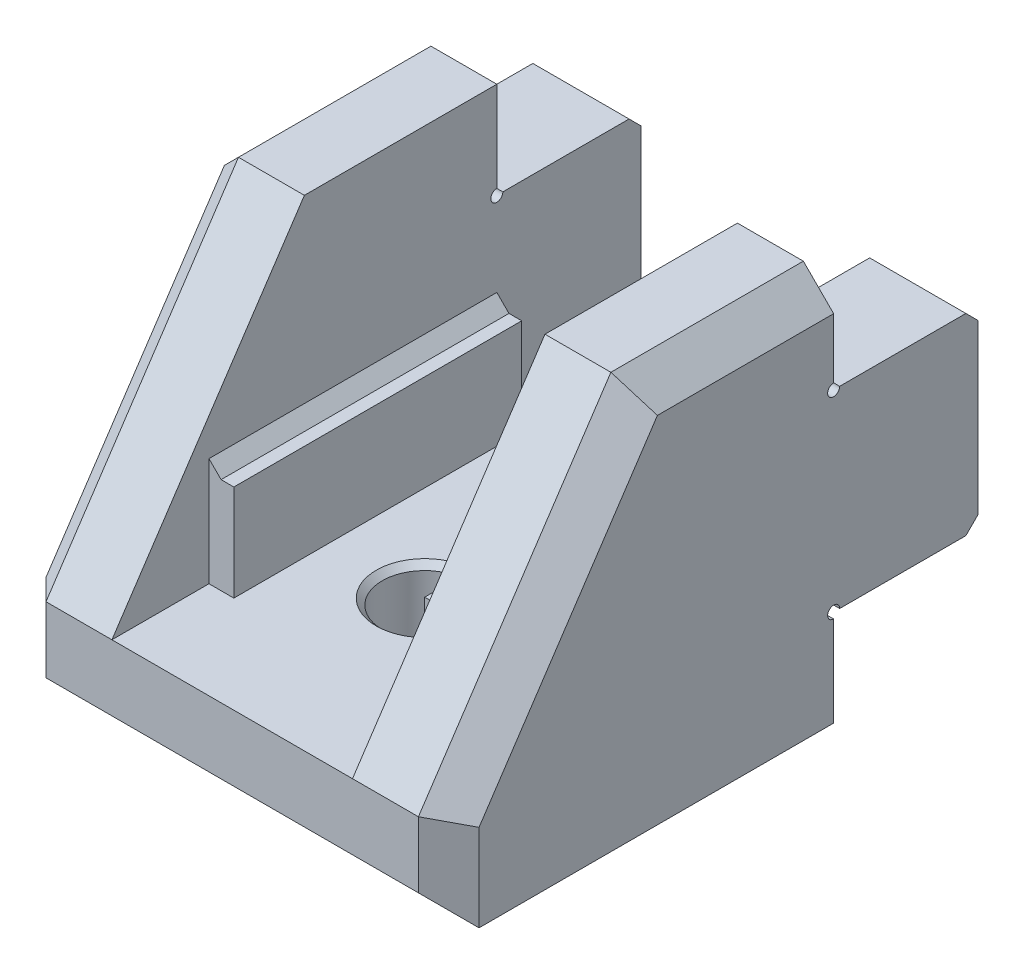
from build123d import *

# Parameters (mm, degrees)
SKETCH1_W                  = 7.9375
SKETCH1_H                  = 12.7
BOSS_EXTRUDE1_DEPTH        = 3.175
SKETCH1_3_W                = 3.175
SKETCH1_3_H                = 12.7
BOSS_EXTRUDE2_DEPTH        = 12.7
CUT_EXTRUDE2_DEPTH         = 21.143116845
BOSS_EXTRUDE3_DEPTH        = 3.175
SKETCH4_W                  = 3.175
SKETCH4_H                  = 6.35
BOSS_EXTRUDE4_DEPTH        = 4.7625
SKETCH5_R                  = 0.1984375
CUT_EXTRUDE3_DEPTH         = 23.11131639
CHAMFER1_SIZE              = 0.4
CHAMFER2_SIZE              = 1
F_35_0_11_DIAMETER_HOLE1_D = 2.794
CHAMFER3_SIZE              = 0.2


with BuildPart() as part:
    # Sketch1 → Boss-Extrude1 (new body)
    with BuildSketch(Plane(origin=(0, 0, 0), x_dir=(1, 0, 0), z_dir=(0, 1, 0))):
        Rectangle(SKETCH1_W, SKETCH1_H)
    extrude(amount=BOSS_EXTRUDE1_DEPTH)

    # Sketch1<3> → Boss-Extrude2 (add)
    with BuildSketch(Plane(origin=(0, 0, 0), x_dir=(1, 0, 0), z_dir=(0, 1, 0))):
        with Locations((5.55625, 0)):
            Rectangle(SKETCH1_3_W, SKETCH1_3_H)
        with Locations((-5.55625, 0)):
            Rectangle(SKETCH1_3_W, SKETCH1_3_H)
    extrude(amount=BOSS_EXTRUDE2_DEPTH)

    # Sketch2 → Cut-Extrude2 (cut, through all)
    with BuildSketch(Plane(origin=(7.14375, 0, 0), x_dir=(0, 0, -1), z_dir=(1, 0, 0))):
        Polygon((-6.35, 3.175), (0, 12.7), (-6.35, 12.7), align=None)
    extrude(amount=-CUT_EXTRUDE2_DEPTH, mode=Mode.SUBTRACT)

    # Sketch3 → Boss-Extrude3 (add)
    with BuildSketch(Plane(origin=(0, 3.175, 0), x_dir=(1, 0, 0), z_dir=(0, 1, 0))):
        Polygon((-3.148, 3.148), (-3.148, 6.35), (-3.96875, 6.35), (-3.96875, -3.148), (-3.148, -3.148), align=None)
        Polygon((3.148, 3.148), (3.148, -3.148), (3.96875, -3.148), (3.96875, 6.35), (3.148, 6.35), align=None)
    extrude(amount=BOSS_EXTRUDE3_DEPTH)

    # Sketch4 → Boss-Extrude4 (add)
    with BuildSketch(Plane(origin=(0, 0, -6.35), x_dir=(-1, 0, 0), z_dir=(0, 0, -1))):
        with Locations((-5.55625, 6.35)):
            Rectangle(SKETCH4_W, SKETCH4_H)
        with Locations((5.55625, 6.35)):
            Rectangle(SKETCH4_W, SKETCH4_H)
    extrude(amount=BOSS_EXTRUDE4_DEPTH)

    # Sketch5 → Cut-Extrude3 (cut, through all)
    with BuildSketch(Plane(origin=(7.14375, 0, 0), x_dir=(0, 0, -1), z_dir=(1, 0, 0))):
        with Locations((6.35, 9.525)):
            Circle(SKETCH5_R)
        with Locations((6.35, 3.175)):
            Circle(SKETCH5_R)
    extrude(amount=-CUT_EXTRUDE3_DEPTH, mode=Mode.SUBTRACT)

    # Chamfer1
    chamfer1_edges = [part.edges().sort_by_distance(p)[0] for p in [
        (-5.55625, 9.525, -11.1125),
        (-5.55625, 3.175, -11.1125),
        (5.55625, 3.175, -11.1125),
        (5.55625, 9.525, -11.1125),
        (3.96875, 6.35, -1.601),
        (-3.96875, 6.35, -1.601),
    ]]
    chamfer(chamfer1_edges, length=CHAMFER1_SIZE)

    # Chamfer2
    chamfer2_edges = [part.edges().sort_by_distance(p)[0] for p in [
        (-7.14375, 12.7, -3.175),
        (7.14375, 12.7, -3.175),
        (7.14375, 7.9375, 3.175),
        (-7.14375, 7.9375, 3.175),
        (-7.14375, 1.5875, 6.35),
        (7.14375, 1.5875, 6.35),
        (0, 0, 6.35),
    ]]
    chamfer(chamfer2_edges, length=CHAMFER2_SIZE)

    # #35 (0.11) Diameter Hole1 (through all)
    with Locations(Plane(origin=(0, 3.175, 0), x_dir=(1, 0, 0), z_dir=(0, 1, 0))):
        with Locations((0, 0)):
            Hole(F_35_0_11_DIAMETER_HOLE1_D / 2)

    # Chamfer3
    chamfer3_edges = [part.edges().sort_by_distance(p)[0] for p in [
        (1.397, 3.175, 0),
        (1.397, 0, 0),
    ]]
    chamfer(chamfer3_edges, length=CHAMFER3_SIZE)


solid = part.part
